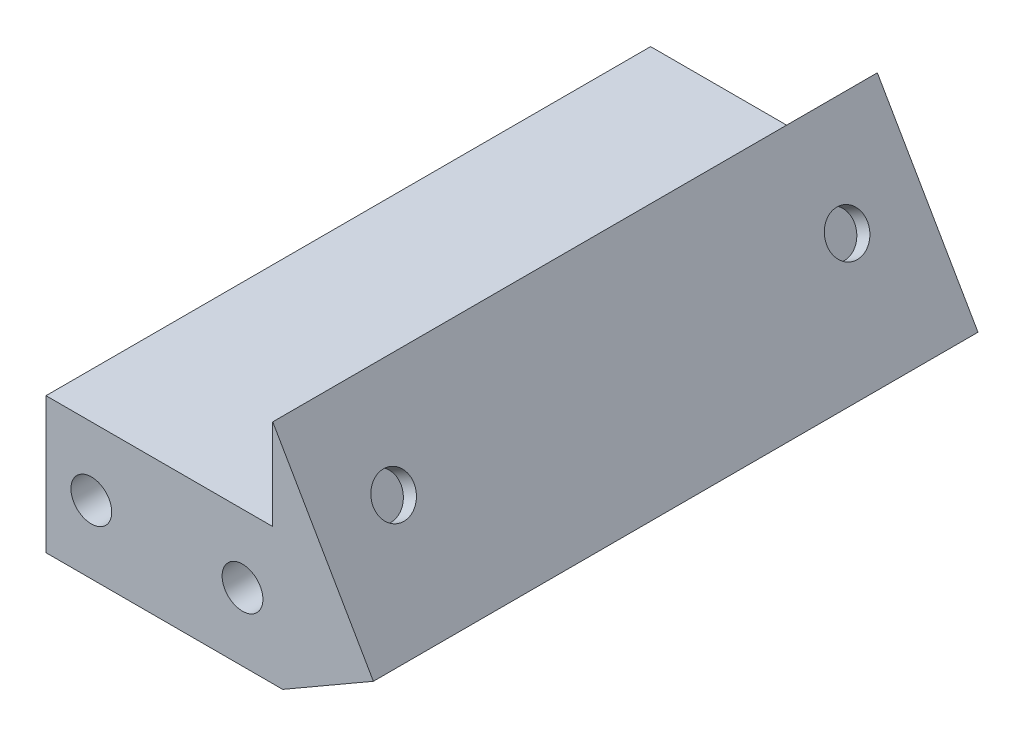
from build123d import *

# Parameters (mm, degrees)
EXTRUDE_1_DEPTH     = 40
SKETCH_2_R          = 1.35
CUT_EXTRUDE_1_DEPTH = 1
SKETCH_3_R          = 1.35
CUT_EXTRUDE_2_DEPTH = 40


with BuildPart() as part:
    # 草图1 → 凸台-拉伸1 (new body)
    with BuildSketch(Plane.XY):
        Polygon((0, 0), (15, 0), (15, 6), (21.660254038, -5.535898385), (15.660254038, -9), (0, -9), align=None)
    extrude(amount=EXTRUDE_1_DEPTH)

    # 草图2 → 切除-拉伸1 (cut)
    with BuildSketch(Plane(origin=(13.848076211, 7.995190528, 0), x_dir=(0, 0, -1), z_dir=(0.8660254037844386, 0.4999999999999999, 0))):
        with Locations(Location((-5, -8.30384758, 0), (0, 0, 90))):
            Circle(SKETCH_2_R)
    cut_extrude_1 = extrude(amount=-CUT_EXTRUDE_1_DEPTH, mode=Mode.SUBTRACT)

    # 镜向1: 切除-拉伸1 across plane
    add(cut_extrude_1.mirror(Plane.XY.offset(20)), mode=Mode.SUBTRACT)

    # 草图3 → 切除-拉伸2 (cut)
    with BuildSketch(Plane.XY.offset(40)):
        with Locations((3, -4.5)):
            Circle(SKETCH_3_R)
        with Locations((13, -4.5)):
            Circle(SKETCH_3_R)
    extrude(amount=-CUT_EXTRUDE_2_DEPTH, mode=Mode.SUBTRACT)


solid = part.part
